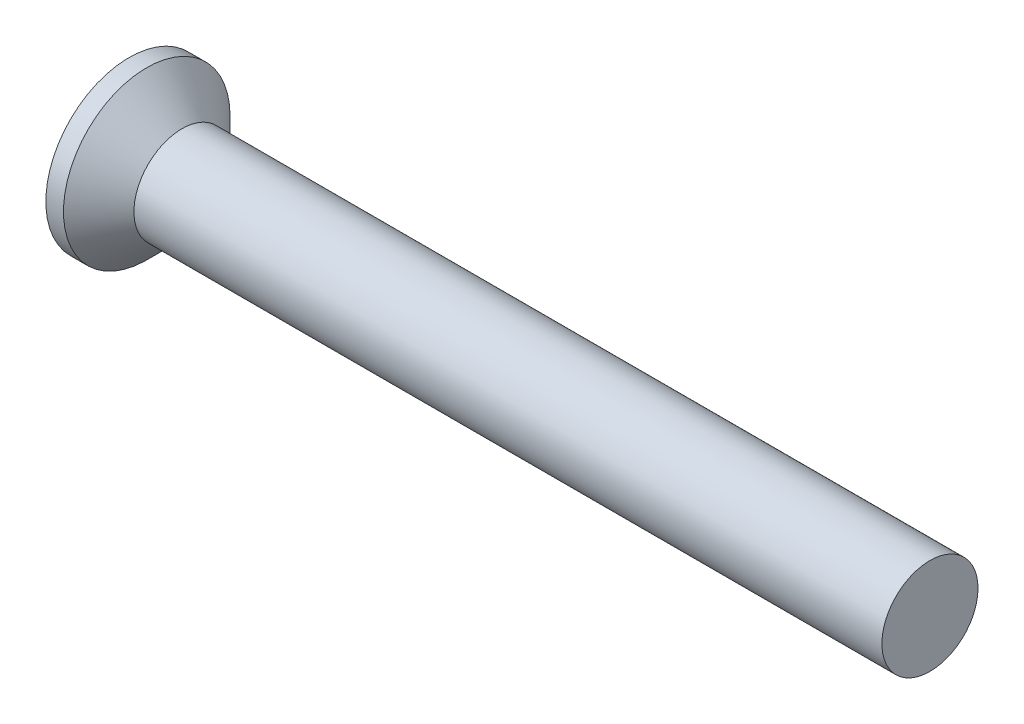
from build123d import *

# Parameters (mm, degrees)
CROSSRECESS_DEPTH = 0.825
DRAFT9_ANGLE      = 30
FILLET5_R         = 0.3


with BuildPart() as part:
    # Sketch1 → Base (revolve)
    with BuildSketch(Plane.XY, mode=Mode.PRIVATE) as base_sk:
        Polygon((25, 1.5), (2.65, 1.5), (1.65, 1.5), (0.55, 2.6), (0, 2.6), (0, 0), (25, 0), align=None)
    revolve(base_sk.sketch.rotate(Axis((4.515812911, 0, 0), (-1, 0, 0)), 90), axis=Axis((4.515812911, 0, 0), (-1, 0, 0)))

    # Sketch6 → CrossRecess (cut)
    with BuildSketch(Plane(origin=(0, 0, 0), x_dir=(0, 0, -1), z_dir=(1, 0, 0))):
        Polygon((0.32, 0.32), (0.32, 1.6), (-0.32, 1.6), (-0.32, 0.32), (-1.6, 0.32), (-1.6, -0.32), (-0.32, -0.32), (-0.32, -1.6), (0.32, -1.6), (0.32, -0.32), (1.6, -0.32), (1.6, 0.32), align=None)
    extrude(amount=CROSSRECESS_DEPTH, mode=Mode.SUBTRACT)

    # Draft9
    draft9_faces = [part.faces().sort_by_distance(p)[0] for p in [
        (0.4125, 1.6, 0),
        (0.4125, 0, 1.6),
        (0.4125, -1.6, 0),
        (0.4125, 0, -1.6),
    ]]
    draft(draft9_faces, Plane(origin=(0, 2.6, 0), x_dir=(0, 0, -1), z_dir=(-1, 0, 0)), DRAFT9_ANGLE)

    # Fillet5
    fillet5_edges = [part.edges().sort_by_distance(p)[0] for p in [
        (0.4125, 0.32, 0.32),
        (0.4125, -0.32, 0.32),
        (0.4125, -0.32, -0.32),
        (0.4125, 0.32, -0.32),
    ]]
    fillet(fillet5_edges, radius=FILLET5_R)


solid = part.part
